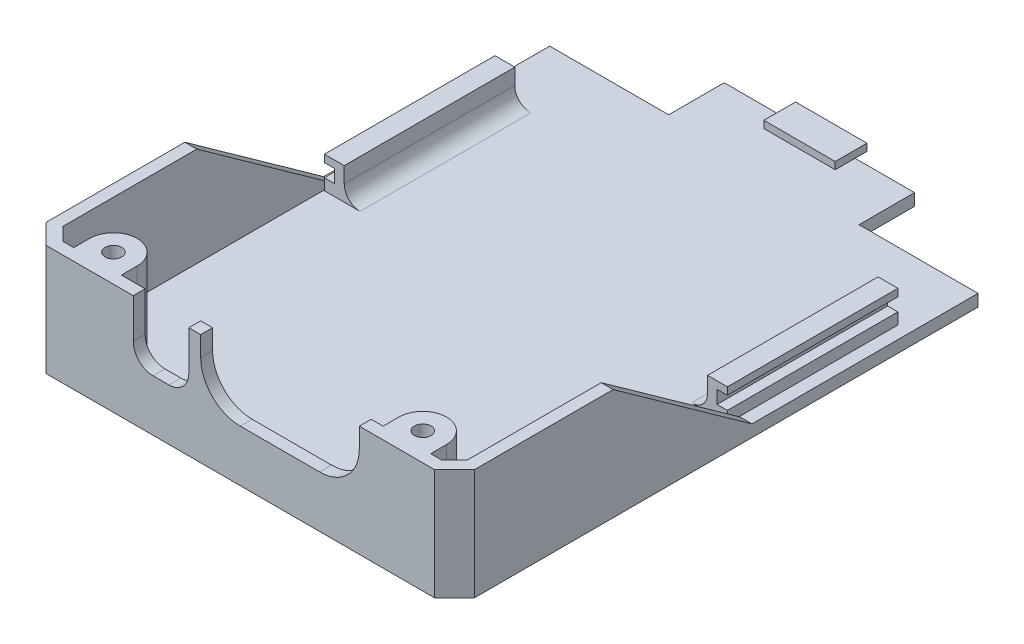
from build123d import *

# Parameters (mm, degrees)
CROQUIS1_R                 = 3.75
SALIENTE_EXTRUIR1_DEPTH    = 3
SALIENTE_EXTRUIR5_START    = -17
SALIENTE_EXTRUIR5_DEPTH    = 43
SALIENTE_EXTRUIR3_DEPTH    = 3
CROQUIS4_R                 = 3.75
SALIENTE_EXTRUIR4_DEPTH    = 25
SALIENTE_EXTRUIR7_START    = -3
CROQUIS8_R                 = 3.75
CROQUIS8_R_2               = 2.1
SALIENTE_EXTRUIR7_DEPTH    = 3
CROQUIS7_W                 = 18
CROQUIS7_H                 = 8
SALIENTE_EXTRUIR6_DEPTH    = 1.8
CORTAR_EXTRUIR1_DEPTH      = 161.937876213
CORTAR_EXTRUIR1_DEPTH_BACK = 10


with BuildPart() as part:
    # Croquis1 → Saliente-Extruir1 (new body)
    with BuildSketch(Plane(origin=(0, 0, 0), x_dir=(1, 0, 0), z_dir=(0, 1, 0))):
        Polygon((-24, 60), (24, 60), (24, 46), (54, 46), (54, -81), (49, -86), (-49, -86), (-54, -81), (-54, 46), (-24, 46), align=None)
        with Locations(Location((-39, -79, 0), (0, 0, 270))):
            Circle(CROQUIS1_R, mode=Mode.SUBTRACT)
        with Locations(Location((39, -79, 0), (0, 0, 90))):
            Circle(CROQUIS1_R, mode=Mode.SUBTRACT)
    extrude(amount=SALIENTE_EXTRUIR1_DEPTH)

    # Croquis6 → Saliente-Extruir5 (add)
    with BuildSketch(Plane(origin=(0, 0, -46), x_dir=(-1, 0, 0), z_dir=(0, 0, -1)).offset(SALIENTE_EXTRUIR5_START)):
        with BuildLine():
            Line((50.8, 3), (50.8, 5.85))
            Line((50.8, 5.85), (48.2, 5.85))
            Line((48.2, 5.85), (48.2, 9.15))
            Line((48.2, 9.15), (50.8, 9.15))
            Line((50.8, 9.15), (50.8, 11))
            Line((50.8, 11), (45.8, 11))
            Line((45.8, 11), (45.8, 7))
            ThreePointArc((45.8, 7), (44.628427125, 4.171572875), (41.8, 3))
            Line((41.8, 3), (47.8, 3))
            Line((47.8, 3), (50.8, 3))
        make_face()
    saliente_extruir5 = extrude(amount=-SALIENTE_EXTRUIR5_DEPTH)

    # Croquis3 → Saliente-Extruir3 (add)
    with BuildSketch(Plane.ZY.offset(54)):
        Polygon((11, 3), (46, 28), (79.207391253, 28), (79.207391253, 3), align=None)
    saliente_extruir3 = extrude(amount=-SALIENTE_EXTRUIR3_DEPTH)

    # Croquis4 → Saliente-Extruir4 (add)
    with BuildSketch(Plane(origin=(0, 3, 0), x_dir=(1, 0, 0), z_dir=(0, 1, 0))):
        with BuildLine():
            Line((-51, -79.207391253), (-54, -79.207391253))
            Line((-54, -79.207391253), (-54, -81))
            Line((-54, -81), (-49, -86))
            Line((-49, -86), (0, -86))
            Line((0, -86), (0, -83))
            Line((0, -83), (-33, -83))
            Line((-33, -83), (-33, -79))
            ThreePointArc((-33, -79), (-39, -73), (-45, -79))
            Line((-45, -79), (-45, -83))
            Line((-45, -83), (-47.757359313, -83))
            Line((-47.757359313, -83), (-51, -79.757359313))
            Line((-51, -79.757359313), (-51, -79.207391253))
        make_face()
        with Locations((-39, -79)):
            Circle(CROQUIS4_R, mode=Mode.SUBTRACT)
    saliente_extruir4 = extrude(amount=SALIENTE_EXTRUIR4_DEPTH)

    # Croquis8 → Saliente-Extruir7 (add)
    with BuildSketch(Plane(origin=(0, 28, 0), x_dir=(1, 0, 0), z_dir=(0, 1, 0)).offset(SALIENTE_EXTRUIR7_START)):
        with Locations(Location((-39, -79, 0), (0, 0, 270))):
            Circle(CROQUIS8_R)
        with Locations(Location((-39, -79, 0), (0, 0, 270))):
            Circle(CROQUIS8_R_2, mode=Mode.SUBTRACT)
    saliente_extruir7 = extrude(amount=SALIENTE_EXTRUIR7_DEPTH)

    # Simetría1: Saliente-Extruir5, Saliente-Extruir3, Saliente-Extruir4, Saliente-Extruir7 across plane
    add(saliente_extruir5.mirror(Plane(origin=(0, 0, 0), x_dir=(0, 0, 1), z_dir=(1, 0, 0))))
    add(saliente_extruir3.mirror(Plane(origin=(0, 0, 0), x_dir=(0, 0, 1), z_dir=(1, 0, 0))))
    add(saliente_extruir4.mirror(Plane(origin=(0, 0, 0), x_dir=(0, 0, 1), z_dir=(1, 0, 0))))
    add(saliente_extruir7.mirror(Plane(origin=(0, 0, 0), x_dir=(0, 0, 1), z_dir=(1, 0, 0))))

    # Croquis7 → Saliente-Extruir6 (add)
    with BuildSketch(Plane(origin=(0, 3, 0), x_dir=(1, 0, 0), z_dir=(0, 1, 0))):
        with Locations((0, 59)):
            Rectangle(CROQUIS7_W, CROQUIS7_H)
    extrude(amount=SALIENTE_EXTRUIR6_DEPTH)

    # Croquis9 → Cortar-Extruir1 (cut, two sides: drawn at the far end of the back side and taken through both)
    with BuildSketch(Plane.XY.offset(86).offset(-CORTAR_EXTRUIR1_DEPTH_BACK)):
        with BuildLine():
            Line((30, 28), (-10, 28))
            Line((-10, 28), (-10, 23))
            ThreePointArc((-10, 23), (-7.071067812, 15.928932188), (0, 13))
            Line((0, 13), (20, 13))
            ThreePointArc((20, 13), (27.071067812, 15.928932188), (30, 23))
            Line((30, 23), (30, 28))
        make_face()
        with BuildLine():
            Line((-13, 18), (-13, 28))
            Line((-13, 28), (-27, 28))
            Line((-27, 28), (-27, 18))
            ThreePointArc((-27, 18), (-25.535533906, 14.464466094), (-22, 13))
            Line((-22, 13), (-18, 13))
            ThreePointArc((-18, 13), (-14.464466094, 14.464466094), (-13, 18))
        make_face()
    extrude(amount=CORTAR_EXTRUIR1_DEPTH + CORTAR_EXTRUIR1_DEPTH_BACK, mode=Mode.SUBTRACT)


solid = part.part
